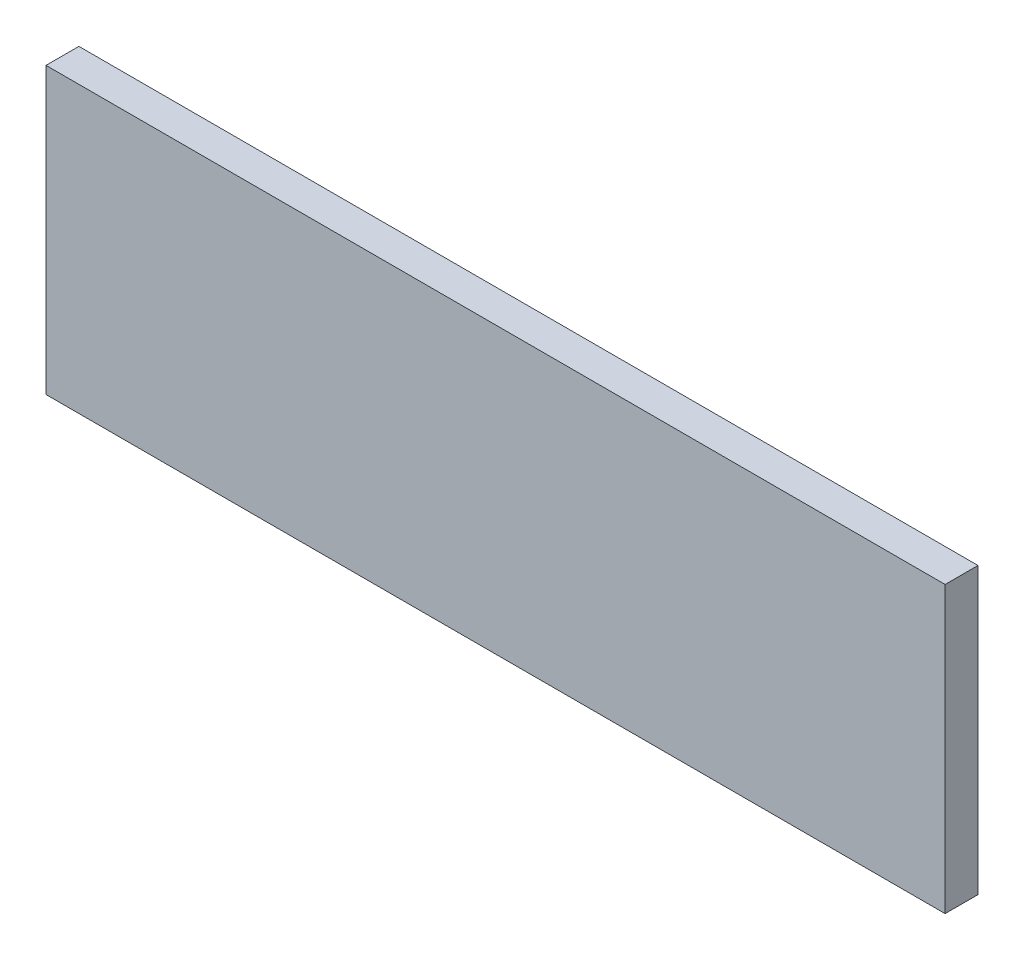
from build123d import *

# Parameters (mm, degrees)
SKETCH_1_W        = 82
SKETCH_1_H        = 26
STEREO_TRAY_DEPTH = 3


with BuildPart() as part:
    # 草图1 → Stereo_Tray (new body)
    with BuildSketch(Plane.XY):
        with Locations((41, 13)):
            Rectangle(SKETCH_1_W, SKETCH_1_H)
    extrude(amount=STEREO_TRAY_DEPTH)


solid = part.part
